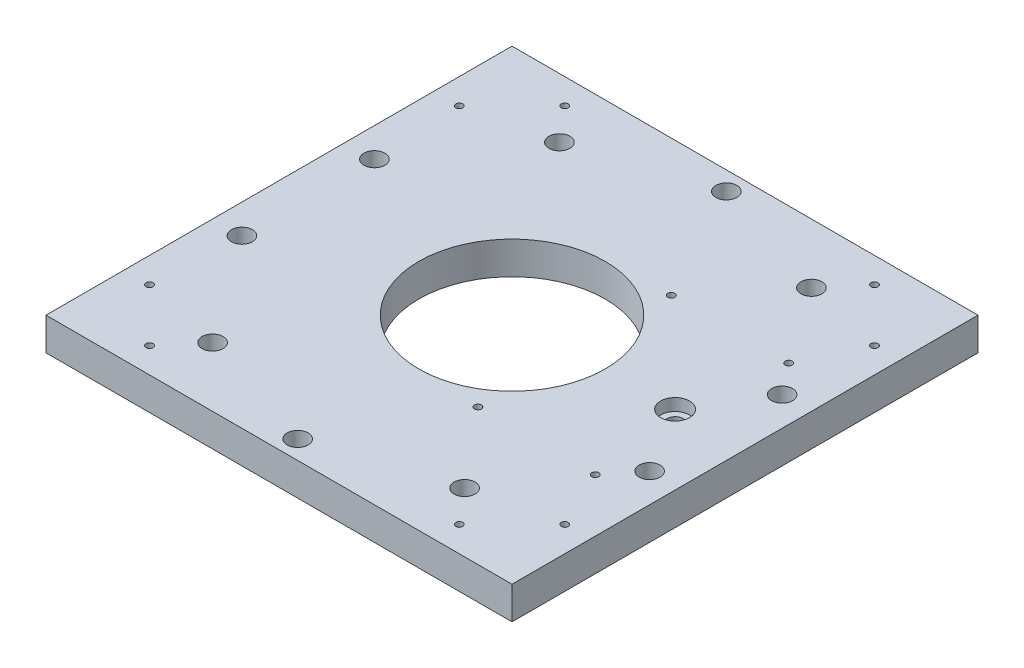
from build123d import *

# Parameters (mm, degrees)
SKETCH_1_W               = 100
SKETCH_1_H               = 100
SKETCH_1_R               = 1.75
SKETCH_1_R_2             = 20
EXTRUDE_1_DEPTH          = 7
CUT_EXTRUDE_START        = 7
SKETCH_1_15_R            = 3.1
CUT_EXTRUDE_2_DEPTH      = 2.6
CUT_EXTRUDE_START_2      = 2.6
SKETCH_1_16_R            = 3.1
CUT_EXTRUDE_3_DEPTH      = 2.6
SKETCH_1_17_R            = 1.5
CUT_EXTRUDE_4_DEPTH      = 113.022319205
SKETCH_1_18_R            = 2.25
CUT_EXTRUDE_5_DEPTH      = 5
PATTERN_CIRCULAR_1_COUNT = 10
SKETCH_2_R               = 0.75
CUT_EXTRUDE_6_DEPTH      = 4
SKETCH_3_R               = 0.75
CUT_EXTRUDE_7_DEPTH      = 113.022319205
PATTERN_CIRCULAR_2_COUNT = 4
SKETCH_3_3_R             = 0.75
CUT_EXTRUDE_8_DEPTH      = 113.022319205


with BuildPart() as part:
    # 草图1 → 凸台-拉伸1 (new body)
    with BuildSketch(Plane(origin=(0, 0, 0), x_dir=(1, 0, 0), z_dir=(0, 1, 0))):
        with Locations((50, 0)):
            Rectangle(SKETCH_1_W, SKETCH_1_H)
        with Locations(Location((85, 0, 0), (0, 0, 270))):
            Circle(SKETCH_1_R, mode=Mode.SUBTRACT)
        with Locations(Location((50, 0, 0), (0, 0, 270))):
            Circle(SKETCH_1_R_2, mode=Mode.SUBTRACT)
    extrude(amount=EXTRUDE_1_DEPTH)

    # 草图1<15> → 切除-拉伸2 (cut)
    with BuildSketch(Plane(origin=(0, 0, 0), x_dir=(1, 0, 0), z_dir=(0, 1, 0)).offset(CUT_EXTRUDE_START)):
        with Locations(Location((85, 0, 0), (0, 0, 270))):
            Circle(SKETCH_1_15_R)
    extrude(amount=-CUT_EXTRUDE_2_DEPTH, mode=Mode.SUBTRACT)

    # 草图1<16> → 切除-拉伸3 (cut)
    with BuildSketch(Plane(origin=(0, 0, 0), x_dir=(1, 0, 0), z_dir=(0, 1, 0)).offset(CUT_EXTRUDE_START_2)):
        with Locations(Location((85, 0, 0), (0, 0, 270))):
            Circle(SKETCH_1_16_R)
    extrude(amount=-CUT_EXTRUDE_3_DEPTH, mode=Mode.SUBTRACT)

    # 草图1<17> → 切除-拉伸4 (cut, through all)
    with BuildSketch(Plane(origin=(0, 0, 0), x_dir=(1, 0, 0), z_dir=(0, 1, 0))):
        with Locations(Location((50, 46, 0), (0, 0, 270))):
            Circle(SKETCH_1_17_R)
    cut_extrude_4 = extrude(amount=CUT_EXTRUDE_4_DEPTH, mode=Mode.SUBTRACT)

    # 草图1<18> → 切除-拉伸5 (cut)
    with BuildSketch(Plane(origin=(0, 0, 0), x_dir=(1, 0, 0), z_dir=(0, 1, 0)).offset(CUT_EXTRUDE_START)):
        with Locations(Location((50, 46, 0), (0, 0, 270))):
            Circle(SKETCH_1_18_R)
    cut_extrude_5 = extrude(amount=-CUT_EXTRUDE_5_DEPTH, mode=Mode.SUBTRACT)

    # 阵列(圆周)1: 切除-拉伸4, 切除-拉伸5 ×10 about axis
    pattern_circular_1_axis = Axis((50, 0, 0), (0, 1, 0))
    add([cut_extrude_4.rotate(pattern_circular_1_axis, i * 360 / PATTERN_CIRCULAR_1_COUNT) for i in range(1, PATTERN_CIRCULAR_1_COUNT)], mode=Mode.SUBTRACT)
    add([cut_extrude_5.rotate(pattern_circular_1_axis, i * 360 / PATTERN_CIRCULAR_1_COUNT) for i in range(1, PATTERN_CIRCULAR_1_COUNT)], mode=Mode.SUBTRACT)

    # 草图2 → 切除-拉伸6 (cut)
    with BuildSketch(Plane.XZ):
        with Locations(Location((85, 9, 0), (0, 0, 270))):
            Circle(SKETCH_2_R)
        with Locations(Location((85, -9, 0), (0, 0, 270))):
            Circle(SKETCH_2_R)
    extrude(amount=-CUT_EXTRUDE_6_DEPTH, mode=Mode.SUBTRACT)

    # 草图3 → 切除-拉伸7 (cut, through all)
    with BuildSketch(Plane(origin=(0, 7, 0), x_dir=(1, 0, 0), z_dir=(0, 1, 0))):
        with Locations(Location((5.452272785, 33.234018716, 0), (0, 0, 270))):
            Circle(SKETCH_3_R)
        with Locations(Location((16.765981284, 44.547727215, 0), (0, 0, 270))):
            Circle(SKETCH_3_R)
    cut_extrude_7 = extrude(amount=-CUT_EXTRUDE_7_DEPTH, mode=Mode.SUBTRACT)

    # 阵列(圆周)2: 切除-拉伸7 ×4 about axis
    pattern_circular_2_axis = Axis((50, 0, 0), (0, 1, 0))
    for i in range(1, PATTERN_CIRCULAR_2_COUNT):
        add(cut_extrude_7.rotate(pattern_circular_2_axis, i * 360 / PATTERN_CIRCULAR_2_COUNT), mode=Mode.SUBTRACT)

    # 草图3<3> → 切除-拉伸8 (cut, through all)
    with BuildSketch(Plane(origin=(0, 7, 0), x_dir=(1, 0, 0), z_dir=(0, 1, 0))):
        with Locations(Location((63.404969626, 20.785281374, 0), (0, 0, 270))):
            Circle(SKETCH_3_3_R)
        with Locations(Location((88.584828776, 20.785281374, 0), (0, 0, 270))):
            Circle(SKETCH_3_3_R)
        with Locations(Location((63.404969626, -20.714718626, 0), (0, 0, 270))):
            Circle(SKETCH_3_3_R)
        with Locations(Location((88.584828776, -20.714718626, 0), (0, 0, 270))):
            Circle(SKETCH_3_3_R)
    extrude(amount=-CUT_EXTRUDE_8_DEPTH, mode=Mode.SUBTRACT)


solid = part.part
